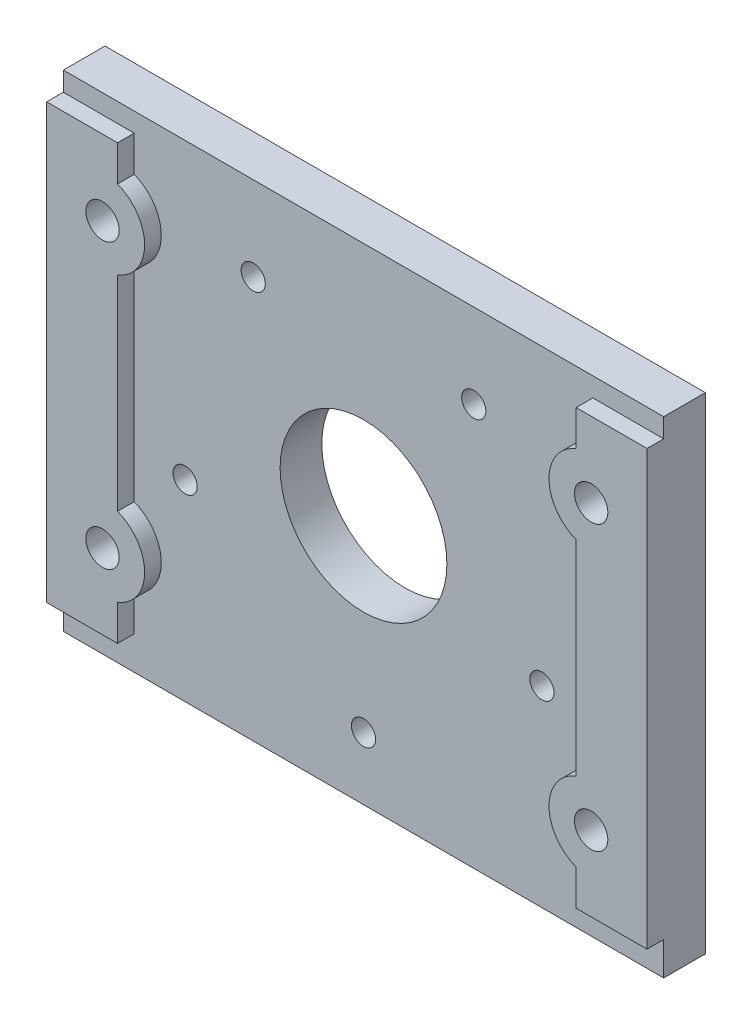
from build123d import *

# Parameters (mm, degrees)
SKETCH1_W           = 72
SKETCH1_H           = 58.3
SKETCH1_R           = 10
SKETCH1_R_2         = 1.45
BOSS_EXTRUDE1_DEPTH = 5
SKETCH2_W           = 8.5
SKETCH2_H           = 52
BOSS_EXTRUDE2_DEPTH = 7
SKETCH3_R           = 5.05
BOSS_EXTRUDE3_DEPTH = 7
SKETCH4_R           = 5.05
BOSS_EXTRUDE4_DEPTH = 7
SKETCH5_R           = 2
CUT_EXTRUDE1_DEPTH  = 6.7
SKETCH6_W           = 8.5
SKETCH6_H           = 52
BOSS_EXTRUDE5_DEPTH = 7
SKETCH7_R           = 5.05
BOSS_EXTRUDE6_DEPTH = 7
SKETCH8_R           = 5.05
BOSS_EXTRUDE7_DEPTH = 7
SKETCH9_R           = 2
CUT_EXTRUDE2_DEPTH  = 6.7


with BuildPart() as part:
    # Sketch1 → Boss-Extrude1 (new body)
    with BuildSketch(Plane.XY.offset(280)):
        with Locations((300, 299.15)):
            Rectangle(SKETCH1_W, SKETCH1_H)
        with Locations((300, 300)):
            Circle(SKETCH1_R, mode=Mode.SUBTRACT)
        with Locations((286.774831823, 318.202882373)):
            Circle(SKETCH1_R_2, mode=Mode.SUBTRACT)
        with Locations((278.601228383, 293.047117627)):
            Circle(SKETCH1_R_2, mode=Mode.SUBTRACT)
        with Locations((300, 277.5)):
            Circle(SKETCH1_R_2, mode=Mode.SUBTRACT)
        with Locations((321.398771617, 293.047117627)):
            Circle(SKETCH1_R_2, mode=Mode.SUBTRACT)
        with Locations((313.225168177, 318.202882373)):
            Circle(SKETCH1_R_2, mode=Mode.SUBTRACT)
    extrude(amount=BOSS_EXTRUDE1_DEPTH)

    # Sketch2 → Boss-Extrude2 (add)
    with BuildSketch(Plane.XY.offset(280)):
        with Locations((268.25, 300)):
            Rectangle(SKETCH2_W, SKETCH2_H)
    extrude(amount=BOSS_EXTRUDE2_DEPTH)

    # Sketch3 → Boss-Extrude3 (add)
    with BuildSketch(Plane.XY.offset(280)):
        with Locations((270.7, 283)):
            Circle(SKETCH3_R)
    extrude(amount=BOSS_EXTRUDE3_DEPTH)

    # Sketch4 → Boss-Extrude4 (add)
    with BuildSketch(Plane.XY.offset(280)):
        with Locations((270.7, 317)):
            Circle(SKETCH4_R)
    extrude(amount=BOSS_EXTRUDE4_DEPTH)

    # Sketch5 → Cut-Extrude1 (cut)
    with BuildSketch(Plane.XY.offset(280.3)):
        with Locations((270.7, 283)):
            Circle(SKETCH5_R)
        with Locations((270.7, 317)):
            Circle(SKETCH5_R)
    extrude(amount=CUT_EXTRUDE1_DEPTH, mode=Mode.SUBTRACT)

    # Sketch6 → Boss-Extrude5 (add)
    with BuildSketch(Plane.XY.offset(280)):
        with Locations((331.75, 300)):
            Rectangle(SKETCH6_W, SKETCH6_H)
    extrude(amount=BOSS_EXTRUDE5_DEPTH)

    # Sketch7 → Boss-Extrude6 (add)
    with BuildSketch(Plane.XY.offset(280)):
        with Locations((329.3, 283)):
            Circle(SKETCH7_R)
    extrude(amount=BOSS_EXTRUDE6_DEPTH)

    # Sketch8 → Boss-Extrude7 (add)
    with BuildSketch(Plane.XY.offset(280)):
        with Locations((329.3, 317)):
            Circle(SKETCH8_R)
    extrude(amount=BOSS_EXTRUDE7_DEPTH)

    # Sketch9 → Cut-Extrude2 (cut)
    with BuildSketch(Plane.XY.offset(280.3)):
        with Locations((329.3, 283)):
            Circle(SKETCH9_R)
        with Locations((329.3, 317)):
            Circle(SKETCH9_R)
    extrude(amount=CUT_EXTRUDE2_DEPTH, mode=Mode.SUBTRACT)


solid = part.part
